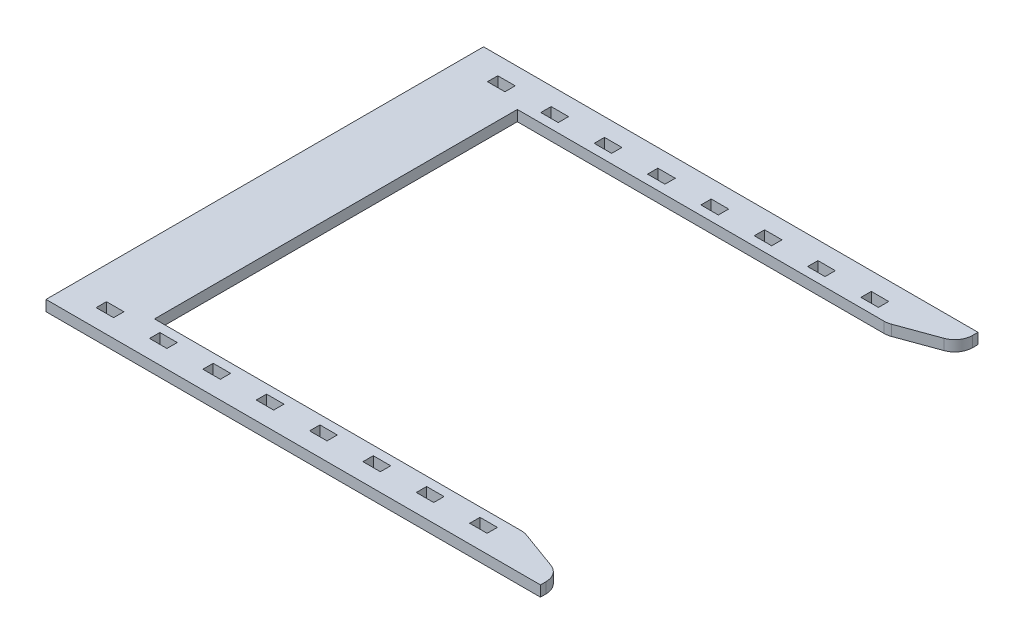
from build123d import *
from OCP.BRepFilletAPI import BRepFilletAPI_MakeChamfer

# Parameters (mm, degrees)
BOSS_EXTRUDE1_DEPTH = 6
SKETCH2_W           = 9.8
SKETCH2_H           = 5.8
CUT_EXTRUDE1_DEPTH  = 6
SKETCH5_W           = 20
SKETCH5_H           = 236
CUT_EXTRUDE2_DEPTH  = 6
SKETCH6_W           = 10
SKETCH6_H           = 204
CUT_EXTRUDE3_DEPTH  = 20
SKETCH7_W           = 32
SKETCH7_H           = 236
CUT_EXTRUDE4_DEPTH  = 20
SKETCH8_W           = 248
SKETCH8_H           = 6
BOSS_EXTRUDE2_DEPTH = 5
SKETCH10_W          = 30
SKETCH10_H          = 204
BOSS_EXTRUDE3_DEPTH = 6
SKETCH11_W          = 21
SKETCH11_H          = 6
BOSS_EXTRUDE4_DEPTH = 30
CHAMFER1_SIZE       = 30
CHAMFER1_SIZE2      = 10.919107028
FILLET1_R           = 10


with BuildPart() as part:
    # Sketch1 → Boss-Extrude1 (new body)
    with BuildSketch(Plane(origin=(0, 0, 0), x_dir=(1, 0, 0), z_dir=(0, 1, 0))):
        Polygon((-150, 118), (-150, -118), (150, -118), (150, -102), (-98, -102), (-98, 102), (150, 102), (150, 118), align=None)
    extrude(amount=BOSS_EXTRUDE1_DEPTH)

    # Sketch2 → Cut-Extrude1 (cut)
    with BuildSketch(Plane(origin=(0, 6, 0), x_dir=(1, 0, 0), z_dir=(0, 1, 0))):
        with Locations((85, -110)):
            Rectangle(SKETCH2_W, SKETCH2_H)
        with Locations((115, -110)):
            Rectangle(SKETCH2_W, SKETCH2_H)
        with Locations((55, -110)):
            Rectangle(SKETCH2_W, SKETCH2_H)
        with Locations((25, -110)):
            Rectangle(SKETCH2_W, SKETCH2_H)
        with Locations((-5, -110)):
            Rectangle(SKETCH2_W, SKETCH2_H)
        with Locations((-35, -110)):
            Rectangle(SKETCH2_W, SKETCH2_H)
        with Locations((-65, -110)):
            Rectangle(SKETCH2_W, SKETCH2_H)
        with Locations((-95, -110)):
            Rectangle(SKETCH2_W, SKETCH2_H)
    cut_extrude1 = extrude(amount=-CUT_EXTRUDE1_DEPTH, mode=Mode.SUBTRACT)

    # Mirror1: Cut-Extrude1 across plane
    add(cut_extrude1.mirror(Plane.XY), mode=Mode.SUBTRACT)

    # Sketch5 → Cut-Extrude2 (cut)
    with BuildSketch(Plane(origin=(0, 6, 0), x_dir=(1, 0, 0), z_dir=(0, 1, 0))):
        with Locations((140, 0)):
            Rectangle(SKETCH5_W, SKETCH5_H)
    extrude(amount=-CUT_EXTRUDE2_DEPTH, mode=Mode.SUBTRACT)

    # Sketch6 → Cut-Extrude3 (cut)
    with BuildSketch(Plane(origin=(0, 6, 0), x_dir=(1, 0, 0), z_dir=(0, 1, 0))):
        with Locations((-103, 0)):
            Rectangle(SKETCH6_W, SKETCH6_H)
    extrude(amount=-CUT_EXTRUDE3_DEPTH, mode=Mode.SUBTRACT)

    # Sketch7 → Cut-Extrude4 (cut)
    with BuildSketch(Plane(origin=(0, 6, 0), x_dir=(1, 0, 0), z_dir=(0, 1, 0))):
        with Locations((-134, 0)):
            Rectangle(SKETCH7_W, SKETCH7_H)
    extrude(amount=-CUT_EXTRUDE4_DEPTH, mode=Mode.SUBTRACT)

    # Sketch8 → Boss-Extrude2 (add)
    with BuildSketch(Plane.XY.offset(118)):
        with Locations((6, 3)):
            Rectangle(SKETCH8_W, SKETCH8_H)
    boss_extrude2 = extrude(amount=BOSS_EXTRUDE2_DEPTH)

    # Mirror2: Boss-Extrude2 across plane
    add(boss_extrude2.mirror(Plane.XY))

    # Sketch10 → Boss-Extrude3 (add, through all)
    with BuildSketch(Plane(origin=(0, 6, 0), x_dir=(1, 0, 0), z_dir=(0, 1, 0))):
        with Locations((-93, 0)):
            Rectangle(SKETCH10_W, SKETCH10_H)
    extrude(amount=-BOSS_EXTRUDE3_DEPTH)

    # Sketch11 → Boss-Extrude4 (add)
    with BuildSketch(Plane(origin=(130, 0, 0), x_dir=(0, 0, -1), z_dir=(1, 0, 0))):
        with Locations((-112.5, 3)):
            Rectangle(SKETCH11_W, SKETCH11_H)
        with Locations((112.5, 3)):
            Rectangle(SKETCH11_W, SKETCH11_H)
    extrude(amount=BOSS_EXTRUDE4_DEPTH)

    # Chamfer1: one chamfer whose edges measure the first distance from different faces: ONE call of the kernel's chamfer builder (chamfer() names one face for all edges)
    chamfer1_edges_1 = [part.edges().sort_by_distance(p)[0] for p in [
        (160, 3, 102),
    ]]
    chamfer1_side_1 = [part.faces().sort_by_distance(p)[0] for p in [
        (41, 3, 102),
    ]]
    chamfer1_edges_2 = [part.edges().sort_by_distance(p)[0] for p in [
        (160, 3, -102),
    ]]
    chamfer1_side_2 = [part.faces().sort_by_distance(p)[0] for p in [
        (41, 3, -102),
    ]]
    chamfer1 = BRepFilletAPI_MakeChamfer(part.part.solid().wrapped)
    for e in chamfer1_edges_1:
        chamfer1.Add(CHAMFER1_SIZE, CHAMFER1_SIZE2, e.wrapped, chamfer1_side_1[0].wrapped)  # the first distance lies on this face
    for e in chamfer1_edges_2:
        chamfer1.Add(CHAMFER1_SIZE, CHAMFER1_SIZE2, e.wrapped, chamfer1_side_2[0].wrapped)  # the first distance lies on this face
    add(Compound.cast(chamfer1.Shape()), mode=Mode.REPLACE)

    # Fillet1
    fillet1_edges = [part.edges().sort_by_distance(p)[0] for p in [
        (160, 3, 112.919107028),
        (130, 3, 102),
        (160, 3, -112.919107028),
        (130, 3, -102),
    ]]
    fillet(fillet1_edges, radius=FILLET1_R)


solid = part.part
